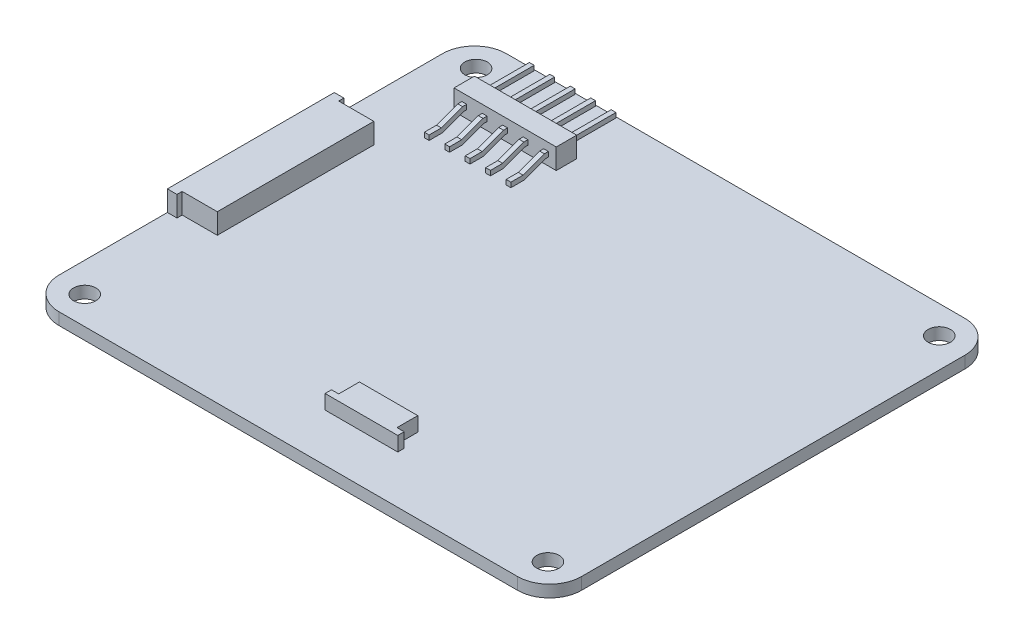
from build123d import *

# Parameters (mm, degrees)
ESQUISSE1_W             = 65.4
ESQUISSE1_H             = 56
BOSS_EXTRU_1_DEPTH      = 1.5
CONG_1_R                = 4
ESQUISSE2_R             = 1.4
ENL_V_MAT_EXTRU_1_DEPTH = 1.5
ESQUISSE3_W             = 12.8
ESQUISSE3_H             = 2.56
BOSS_EXTRU_2_DEPTH      = 2.56
ESQUISSE4_W             = 0.6
ESQUISSE4_H             = 13.16
BOSS_EXTRU_3_DEPTH      = 1.58
ENL_V_MAT_EXTRU_2_REACH = 66.012
ESQUISSE5_W             = 5.9
ESQUISSE5_H             = 0.98
BOSS_EXTRU_4_DEPTH      = 2.56
BOSS_EXTRU_5_DEPTH      = 1.8


with BuildPart() as part:
    # Esquisse1 → Boss.-Extru.1 (new body)
    with BuildSketch(Plane(origin=(0, 0, 0), x_dir=(1, 0, 0), z_dir=(0, 1, 0))):
        Rectangle(ESQUISSE1_W, ESQUISSE1_H)
    extrude(amount=BOSS_EXTRU_1_DEPTH)

    # Congé1
    cong_1_edges = [part.edges().sort_by_distance(p)[0] for p in [
        (32.7, 0.75, 28),
        (-32.7, 0.75, 28),
        (-32.7, 0.75, -28),
        (32.7, 0.75, -28),
    ]]
    fillet(cong_1_edges, radius=CONG_1_R)

    # Esquisse2 → Enlèv. mat.-Extru.1 (cut)
    with BuildSketch(Plane(origin=(0, 1.5, 0), x_dir=(1, 0, 0), z_dir=(0, 1, 0))):
        with Locations(Location((-29, 24.5, 0), (0, 0, 270))):
            Circle(ESQUISSE2_R)
        with Locations(Location((-29, -24.5, 0), (0, 0, 270))):
            Circle(ESQUISSE2_R)
        with Locations(Location((29, -24.5, 0), (0, 0, 270))):
            Circle(ESQUISSE2_R)
        with Locations(Location((29, 24.5, 0), (0, 0, 270))):
            Circle(ESQUISSE2_R)
    extrude(amount=-ENL_V_MAT_EXTRU_1_DEPTH, mode=Mode.SUBTRACT)

    # Esquisse3 → Boss.-Extru.2 (add)
    with BuildSketch(Plane(origin=(0, 1.5, 0), x_dir=(1, 0, 0), z_dir=(0, 1, 0))):
        with Locations((-19.3, 19.72)):
            Rectangle(ESQUISSE3_W, ESQUISSE3_H)
    extrude(amount=BOSS_EXTRU_2_DEPTH)

    # Esquisse4 → Boss.-Extru.3 (add)
    with BuildSketch(Plane(origin=(0, 1.5, 0), x_dir=(1, 0, 0), z_dir=(0, 1, 0))):
        with Locations((-24.42, 20.32)):
            Rectangle(ESQUISSE4_W, ESQUISSE4_H)
        with Locations((-21.86, 20.32)):
            Rectangle(ESQUISSE4_W, ESQUISSE4_H)
        with Locations((-19.3, 20.32)):
            Rectangle(ESQUISSE4_W, ESQUISSE4_H)
        with Locations((-16.74, 20.32)):
            Rectangle(ESQUISSE4_W, ESQUISSE4_H)
        with Locations((-14.18, 20.32)):
            Rectangle(ESQUISSE4_W, ESQUISSE4_H)
    extrude(amount=BOSS_EXTRU_3_DEPTH)

    # Enlèv. mat.-Extru.2: up to this face of the body (flat: up to its plane)
    enl_v_mat_extru_2_end = Plane(part.part.faces().sort_by_distance((-13.88, 2.29, -16.09))[0])
    # Esquisse5 → Enlèv. mat.-Extru.2 (cut, up to the picked face)
    with BuildSketch(Plane.ZY.offset(24.72), mode=Mode.PRIVATE) as enl_v_mat_extru_2_sk1:
        with Locations((-23.95, 1.99)):
            Rectangle(ESQUISSE5_W, ESQUISSE5_H)
    enl_v_mat_extru_2_tool1 = split(extrude(enl_v_mat_extru_2_sk1.sketch, amount=-ENL_V_MAT_EXTRU_2_REACH, mode=Mode.PRIVATE), bisect_by=enl_v_mat_extru_2_end, keep=Keep.BOTH, mode=Mode.PRIVATE)
    # Esquisse5 → Enlèv. mat.-Extru.2 (cut, up to the picked face)
    with BuildSketch(Plane.ZY.offset(24.72), mode=Mode.PRIVATE) as enl_v_mat_extru_2_sk2:
        with BuildLine():
            Line((-17.9329542, 3.08), (-15.267871538, 2.100055504))
            Line((-15.267871538, 2.100055504), (-13.74, 2.100055504))
            ThreePointArc((-13.74, 2.100055504), (-13.106146425, 2.552094428), (-13.327063257, 3.298623259))
            Line((-13.327063257, 3.298623259), (-17.9329542, 3.47707173))
            Line((-17.9329542, 3.47707173), (-17.9329542, 3.08))
        make_face()
    enl_v_mat_extru_2_tool2 = split(extrude(enl_v_mat_extru_2_sk2.sketch, amount=-ENL_V_MAT_EXTRU_2_REACH, mode=Mode.PRIVATE), bisect_by=enl_v_mat_extru_2_end, keep=Keep.BOTH, mode=Mode.PRIVATE)
    # Esquisse5 → Enlèv. mat.-Extru.2 (cut, up to the picked face)
    with BuildSketch(Plane.ZY.offset(24.72), mode=Mode.PRIVATE) as enl_v_mat_extru_2_sk3:
        Polygon((-18.44, 2.48), (-18.039767565, 2.48), (-15.374533954, 1.5), (-18.44, 1.5), align=None)
    enl_v_mat_extru_2_tool3 = split(extrude(enl_v_mat_extru_2_sk3.sketch, amount=-ENL_V_MAT_EXTRU_2_REACH, mode=Mode.PRIVATE), bisect_by=enl_v_mat_extru_2_end, keep=Keep.BOTH, mode=Mode.PRIVATE)
    add(enl_v_mat_extru_2_tool1.solids().sort_by(Axis((-24.72, 1.99, -23.95), (1, 0, 0)))[0], mode=Mode.SUBTRACT)
    add(enl_v_mat_extru_2_tool2.solids().sort_by(Axis((-24.72, 2.834984, -15.224036), (1, 0, 0)))[0], mode=Mode.SUBTRACT)
    add(enl_v_mat_extru_2_tool3.solids().sort_by(Axis((-24.72, 1.864391, -17.402771), (1, 0, 0)))[0], mode=Mode.SUBTRACT)

    # Esquisse6 → Boss.-Extru.4 (add)
    with BuildSketch(Plane(origin=(0, 1.5, 0), x_dir=(1, 0, 0), z_dir=(0, 1, 0))):
        Polygon((-31.5, 10.45), (-32.7, 10.45), (-32.7, -10.45), (-31.5, -10.45), (-31.5, -9.8), (-27.1, -9.8), (-27.1, 9.8), (-31.5, 9.8), align=None)
    extrude(amount=BOSS_EXTRU_4_DEPTH)

    # Esquisse7 → Boss.-Extru.5 (add)
    with BuildSketch(Plane(origin=(0, 1.5, 0), x_dir=(1, 0, 0), z_dir=(0, 1, 0))):
        Polygon((-0.5, -18.6), (6.8, -18.6), (6.8, -21.2), (7.7, -21.2), (7.7, -22), (-1.4, -22), (-1.4, -21.2), (-0.5, -21.2), align=None)
    extrude(amount=BOSS_EXTRU_5_DEPTH)


solid = part.part
